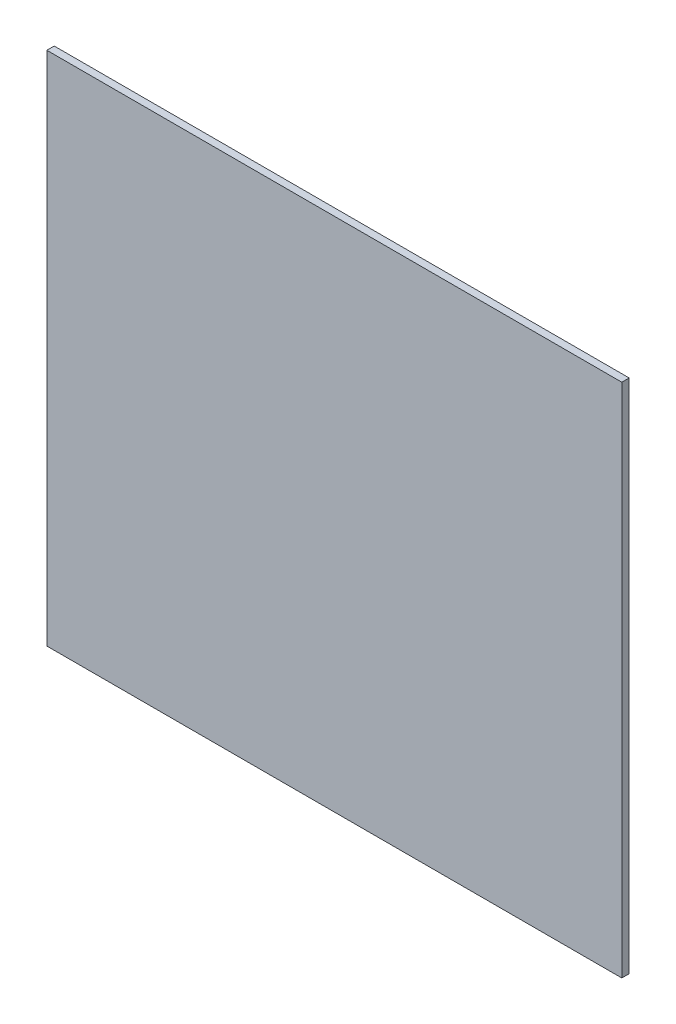
from build123d import *

# Parameters (mm, degrees)
SKETCH1_W      = 123.825
SKETCH1_H      = 111.125
EXTRUDE1_DEPTH = 1.5875


with BuildPart() as part:
    # Sketch1 → Extrude1 (new body)
    with BuildSketch(Plane.XY):
        with Locations((12.7, 0)):
            Rectangle(SKETCH1_W, SKETCH1_H)
    extrude(amount=EXTRUDE1_DEPTH)


solid = part.part
